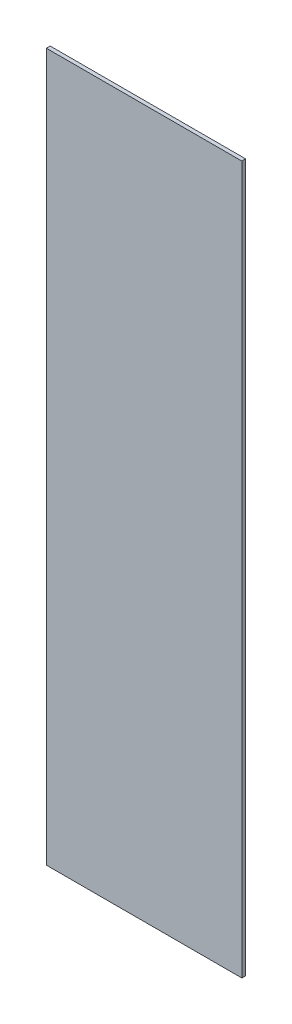
from build123d import *

# Parameters (mm, degrees)
SKETCH1_W           = 81.4
SKETCH1_H           = 294.64
BOSS_EXTRUDE1_DEPTH = 1.5875


with BuildPart() as part:
    # Sketch1 → Boss-Extrude1 (new body)
    with BuildSketch(Plane.XY):
        with Locations((40.7, 147.32)):
            Rectangle(SKETCH1_W, SKETCH1_H)
    extrude(amount=BOSS_EXTRUDE1_DEPTH)


solid = part.part
